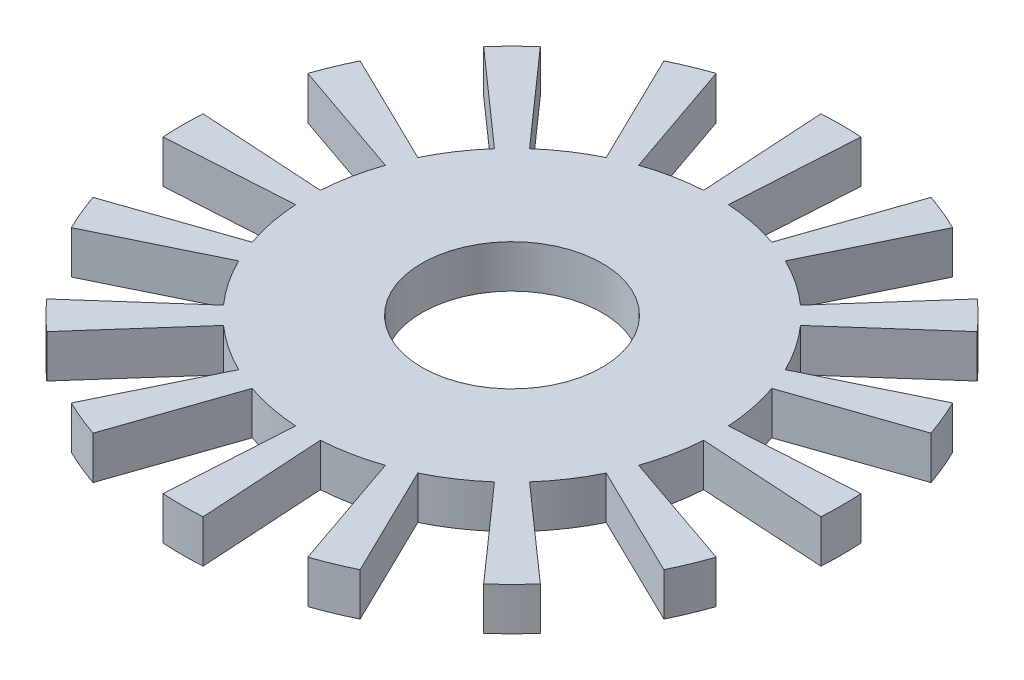
from build123d import *

# Parameters (mm, degrees)
SKETCH2_R           = 10.8077
BOSS_EXTRUDE1_DEPTH = 5.1308


with BuildPart() as part:
    # Sketch2 → Boss-Extrude1 (new body)
    with BuildSketch(Plane(origin=(0, 0, 0), x_dir=(1, 0, 0), z_dir=(0, 1, 0))):
        with BuildLine():
            Line((-17.306656678, 35.509756676), (-10.733030501, 22.022006247))
            ThreePointArc((-10.733030501, 22.022006247), (-13.61052624, 20.369592003), (-16.238327885, 18.34348414))
            Line((-16.238327885, 18.34348414), (-26.183766617, 29.578261448))
            ThreePointArc((-26.183766617, 29.578261448), (-27.932625947, 27.932625947), (-29.578261448, 26.183766617))
            Line((-29.578261448, 26.183766617), (-18.34348414, 16.238327885))
            ThreePointArc((-18.34348414, 16.238327885), (-20.369592003, 13.61052624), (-22.022006247, 10.733030501))
            Line((-22.022006247, 10.733030501), (-35.509756676, 17.306656678))
            ThreePointArc((-35.509756676, 17.306656678), (-36.495734573, 15.117028229), (-37.34684404, 12.871535447))
            Line((-37.34684404, 12.871535447), (-23.161308603, 7.982511303))
            ThreePointArc((-23.161308603, 7.982511303), (-24.027572035, 4.779381236), (-24.453033788, 1.488570263))
            Line((-24.453033788, 1.488570263), (-39.429708177, 2.400270314))
            ThreePointArc((-39.429708177, 2.400270314), (-39.502698446, 0), (-39.429708177, -2.400270314))
            Line((-39.429708177, -2.400270314), (-24.453033788, -1.488570263))
            ThreePointArc((-24.453033788, -1.488570263), (-24.027572035, -4.779381236), (-23.161308603, -7.982511303))
            Line((-23.161308603, -7.982511303), (-37.34684404, -12.871535447))
            ThreePointArc((-37.34684404, -12.871535447), (-36.495734573, -15.117028229), (-35.509756676, -17.306656678))
            Line((-35.509756676, -17.306656678), (-22.022006247, -10.733030501))
            ThreePointArc((-22.022006247, -10.733030501), (-20.369592003, -13.61052624), (-18.34348414, -16.238327885))
            Line((-18.34348414, -16.238327885), (-29.578261448, -26.183766617))
            ThreePointArc((-29.578261448, -26.183766617), (-27.932625947, -27.932625947), (-26.183766617, -29.578261448))
            Line((-26.183766617, -29.578261448), (-16.238327885, -18.34348414))
            ThreePointArc((-16.238327885, -18.34348414), (-13.61052624, -20.369592003), (-10.733030501, -22.022006247))
            Line((-10.733030501, -22.022006247), (-17.306656678, -35.509756676))
            ThreePointArc((-17.306656678, -35.509756676), (-15.117028229, -36.495734573), (-12.871535447, -37.34684404))
            Line((-12.871535447, -37.34684404), (-7.982511303, -23.161308603))
            ThreePointArc((-7.982511303, -23.161308603), (-4.779381236, -24.027572035), (-1.488570263, -24.453033788))
            Line((-1.488570263, -24.453033788), (-2.400270314, -39.429708177))
            ThreePointArc((-2.400270314, -39.429708177), (0, -39.502698446), (2.400270314, -39.429708177))
            Line((2.400270314, -39.429708177), (1.488570263, -24.453033788))
            ThreePointArc((1.488570263, -24.453033788), (4.779381236, -24.027572035), (7.982511303, -23.161308603))
            Line((7.982511303, -23.161308603), (12.871535447, -37.34684404))
            ThreePointArc((12.871535447, -37.34684404), (15.117028229, -36.495734573), (17.306656678, -35.509756676))
            Line((17.306656678, -35.509756676), (10.733030501, -22.022006247))
            ThreePointArc((10.733030501, -22.022006247), (13.61052624, -20.369592003), (16.238327885, -18.34348414))
            Line((16.238327885, -18.34348414), (26.183766617, -29.578261448))
            ThreePointArc((26.183766617, -29.578261448), (27.932625947, -27.932625947), (29.578261448, -26.183766617))
            Line((29.578261448, -26.183766617), (18.34348414, -16.238327885))
            ThreePointArc((18.34348414, -16.238327885), (20.369592003, -13.61052624), (22.022006247, -10.733030501))
            Line((22.022006247, -10.733030501), (35.509756676, -17.306656678))
            ThreePointArc((35.509756676, -17.306656678), (36.495734573, -15.117028229), (37.34684404, -12.871535447))
            Line((37.34684404, -12.871535447), (23.161308603, -7.982511303))
            ThreePointArc((23.161308603, -7.982511303), (24.027572035, -4.779381236), (24.453033788, -1.488570263))
            Line((24.453033788, -1.488570263), (39.429708177, -2.400270314))
            ThreePointArc((39.429708177, -2.400270314), (39.502698446, 0), (39.429708177, 2.400270314))
            Line((39.429708177, 2.400270314), (24.453033788, 1.488570263))
            ThreePointArc((24.453033788, 1.488570263), (24.027572035, 4.779381236), (23.161308603, 7.982511303))
            Line((23.161308603, 7.982511303), (37.34684404, 12.871535447))
            ThreePointArc((37.34684404, 12.871535447), (36.495734573, 15.117028229), (35.509756676, 17.306656678))
            Line((35.509756676, 17.306656678), (22.022006247, 10.733030501))
            ThreePointArc((22.022006247, 10.733030501), (20.369592003, 13.61052624), (18.34348414, 16.238327885))
            Line((18.34348414, 16.238327885), (29.578261448, 26.183766617))
            ThreePointArc((29.578261448, 26.183766617), (27.932625947, 27.932625947), (26.183766617, 29.578261448))
            Line((26.183766617, 29.578261448), (16.238327885, 18.34348414))
            ThreePointArc((16.238327885, 18.34348414), (13.61052624, 20.369592003), (10.733030501, 22.022006247))
            Line((10.733030501, 22.022006247), (17.306656678, 35.509756676))
            ThreePointArc((17.306656678, 35.509756676), (15.117028229, 36.495734573), (12.871535447, 37.34684404))
            Line((12.871535447, 37.34684404), (7.982511303, 23.161308603))
            ThreePointArc((7.982511303, 23.161308603), (4.779381236, 24.027572035), (1.488570263, 24.453033788))
            Line((1.488570263, 24.453033788), (2.400270314, 39.429708177))
            ThreePointArc((2.400270314, 39.429708177), (0, 39.502698446), (-2.400270314, 39.429708177))
            Line((-2.400270314, 39.429708177), (-1.488570263, 24.453033788))
            ThreePointArc((-1.488570263, 24.453033788), (-4.779381236, 24.027572035), (-7.982511303, 23.161308603))
            Line((-7.982511303, 23.161308603), (-12.871535447, 37.34684404))
            ThreePointArc((-12.871535447, 37.34684404), (-15.117028229, 36.495734573), (-17.306656678, 35.509756676))
        make_face()
        with Locations(Location((0, 0, 0), (0, 0, 270))):
            Circle(SKETCH2_R, mode=Mode.SUBTRACT)
    extrude(amount=BOSS_EXTRUDE1_DEPTH)


solid = part.part
